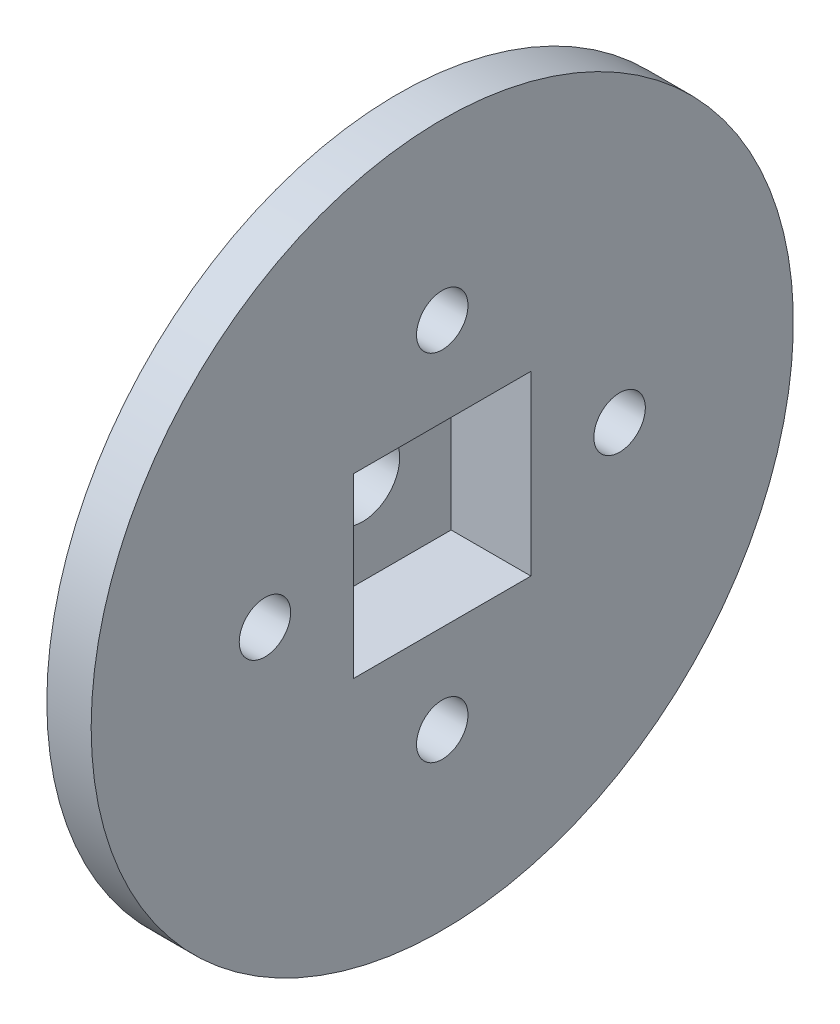
from build123d import *

# Parameters (mm, degrees)
ESQUISSE2_R             = 1.45
ENL_V_MAT_EXTRU_1_DEPTH = 29.219319623
ESQUISSE3_W             = 10
ESQUISSE3_H             = 10
ENL_V_MAT_EXTRU_2_DEPTH = 4.5
BOSS_EXTRU_1_START      = 4
ESQUISSE4_W             = 8
ESQUISSE4_H             = 8
ESQUISSE4_R             = 2.1
BOSS_EXTRU_1_DEPTH      = 4
ESQUISSE5_R             = 3.45
ENL_V_MAT_EXTRU_3_DEPTH = 29.988445974
CHANFREIN1_SIZE         = 0.5


with BuildPart() as part:
    # Esquisse1 → Révolution1 (revolve)
    with BuildSketch(Plane.XY, mode=Mode.PRIVATE) as r_volution1_sk:
        Polygon((0, 19.8), (0, 2.1), (-6, 2.1), (-6, 8), (-2.5, 8), (-2.5, 19.8), align=None)
    revolve(r_volution1_sk.sketch.rotate(Axis((0, 0, 0), (1, 0, 0)), 90), axis=Axis((0, 0, 0), (1, 0, 0)))

    # Esquisse2 → Enlèv. mat.-Extru.1 (cut, through all)
    with BuildSketch(Plane.ZY.offset(2.5)):
        with Locations((0, 10)):
            Circle(ESQUISSE2_R)
        with Locations((-10, 0)):
            Circle(ESQUISSE2_R)
        with Locations((10, 0)):
            Circle(ESQUISSE2_R)
        with Locations((0, -10)):
            Circle(ESQUISSE2_R)
    extrude(amount=-ENL_V_MAT_EXTRU_1_DEPTH, mode=Mode.SUBTRACT)

    # Esquisse3 → Enlèv. mat.-Extru.2 (cut)
    with BuildSketch(Plane(origin=(0, 0, 0), x_dir=(0, 0, -1), z_dir=(1, 0, 0))):
        Rectangle(ESQUISSE3_W, ESQUISSE3_H)
    extrude(amount=-ENL_V_MAT_EXTRU_2_DEPTH, mode=Mode.SUBTRACT)

    # Esquisse4 → Boss.-Extru.1 (add)
    with BuildSketch(Plane.ZY.offset(6).offset(BOSS_EXTRU_1_START)):
        Rectangle(ESQUISSE4_W, ESQUISSE4_H)
        Circle(ESQUISSE4_R, mode=Mode.SUBTRACT)
    extrude(amount=-BOSS_EXTRU_1_DEPTH)

    # Esquisse5 → Enlèv. mat.-Extru.3 (cut, through all)
    with BuildSketch(Plane.ZY.offset(2.5)):
        with Locations((0, 10)):
            Circle(ESQUISSE5_R)
        with Locations((10, 0)):
            Circle(ESQUISSE5_R)
        with Locations((0, -10)):
            Circle(ESQUISSE5_R)
        with Locations((-10, 0)):
            Circle(ESQUISSE5_R)
    extrude(amount=ENL_V_MAT_EXTRU_3_DEPTH, mode=Mode.SUBTRACT)

    # Chanfrein1
    chanfrein1_edges = [part.edges().sort_by_distance(p)[0] for p in [
        (-8, -4, 4),
        (-8, 4, 4),
        (-8, 4, -4),
        (-8, -4, -4),
    ]]
    chamfer(chanfrein1_edges, length=CHANFREIN1_SIZE)


solid = part.part
